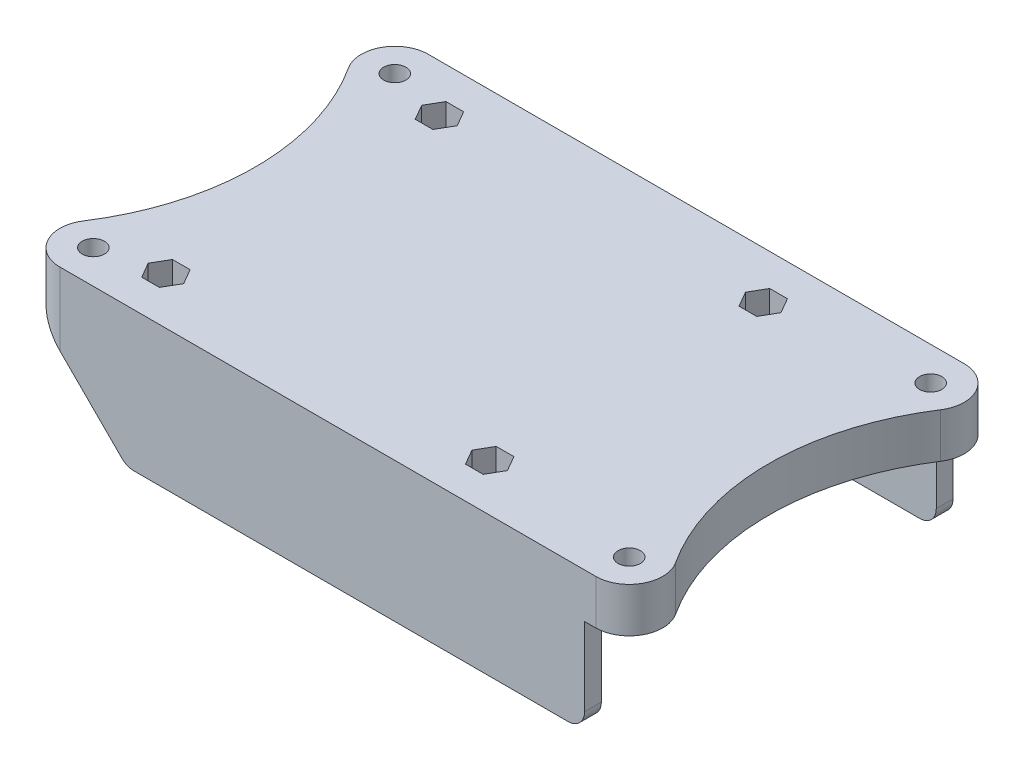
from build123d import *

# Parameters (mm, degrees)
BOSS_EXTRUDE2_DEPTH     = 3
BOSS_EXTRUDE3_DEPTH     = 20
SKETCH7_R               = 3
SKETCH7_R_2             = 1.75
SKETCH7_R_3             = 2.9
SKETCH7_R_4             = 2.1
BOSS_EXTRUDE4_DEPTH     = 4
SKETCH8_R               = 1.35
CUT_EXTRUDE1_DEPTH      = 66.024995194
SKETCH10_W              = 60
SKETCH10_H              = 3
CUT_EXTRUDE2_DEPTH      = 13
FILLET1_R               = 3
SKETCH11_R              = 1.35
BOSS_EXTRUDE5_DEPTH     = 4
FILLET2_R               = 2
BOSS_EXTRUDE6_START     = 5
BOSS_EXTRUDE6_DEPTH     = 5
SKETCH13_R              = 2
BOSS_EXTRUDE7_DEPTH     = 9.5
SKETCH15_R              = 2
BOSS_EXTRUDE9_DEPTH     = 8
BOSS_EXTRUDE11_DEPTH    = 15.5
CUT_EXTRUDE3_DEPTH      = 74.452365517
CUT_EXTRUDE3_DEPTH_BACK = 74.452365517
FILLET4_R               = 1
FILLET5_R               = 3
BOSS_EXTRUDE12_START    = 1
SKETCH22_R              = 2
BOSS_EXTRUDE12_DEPTH    = 1
SKETCH23_W              = 30
SKETCH23_H              = 3
CUT_EXTRUDE6_DEPTH      = 105.393486418


with BuildPart() as part:
    # Sketch4 → Boss-Extrude2 (new body)
    with BuildSketch(Plane(origin=(0, 0, 0), x_dir=(1, 0, 0), z_dir=(0, 1, 0))):
        with BuildLine():
            Line((49.5, 30), (-29.5, 30))
            ThreePointArc((-29.5, 30), (-33.035533906, 28.535533906), (-34.5, 25))
            Line((-34.5, 25), (-34.5, -25))
            ThreePointArc((-34.5, -25), (-33.035533906, -28.535533906), (-29.5, -30))
            Line((-29.5, -30), (49.5, -30))
            Line((49.5, -30), (54.5, -30))
            Line((54.5, -30), (54.5, -25))
            Line((54.5, -25), (54.5, 25))
            Line((54.5, 25), (54.5, 30))
            Line((54.5, 30), (49.5, 30))
        make_face()
    extrude(amount=-BOSS_EXTRUDE2_DEPTH)

    # Sketch5 → Boss-Extrude3 (add)
    with BuildSketch(Plane(origin=(0, 0, 0), x_dir=(1, 0, 0), z_dir=(0, 1, 0))):
        with BuildLine():
            Line((-29.5, -30), (54.5, -30))
            Line((54.5, -30), (54.5, -33))
            Line((54.5, -33), (-29.5, -33))
            ThreePointArc((-29.5, -33), (-35.156854249, -30.656854249), (-37.5, -25))
            Line((-37.5, -25), (-37.5, 25))
            ThreePointArc((-37.5, 25), (-35.156854249, 30.656854249), (-29.5, 33))
            Line((-29.5, 33), (54.5, 33))
            Line((54.5, 33), (54.5, 30))
            Line((54.5, 30), (-29.5, 30))
            ThreePointArc((-29.5, 30), (-33.035533906, 28.535533906), (-34.5, 25))
            Line((-34.5, 25), (-34.5, -25))
            ThreePointArc((-34.5, -25), (-33.035533906, -28.535533906), (-29.5, -30))
        make_face()
    extrude(amount=-BOSS_EXTRUDE3_DEPTH)

    # Sketch7 → Boss-Extrude4 (add)
    with BuildSketch(Plane.XZ.offset(3)):
        with Locations(Location((-29, -24.5, 0), (0, 0, 90))):
            Circle(SKETCH7_R)
        with Locations(Location((-17.5, -16.4, 0), (0, 0, 90))):
            Circle(SKETCH7_R_2)
        with Locations(Location((29, -24.5, 0), (0, 0, 90))):
            Circle(SKETCH7_R)
        with Locations(Location((34.2, 6.8, 0), (0, 0, 90))):
            Circle(SKETCH7_R_3)
        with Locations(Location((29, 24.5, 0), (0, 0, 90))):
            Circle(SKETCH7_R)
        with Locations(Location((-14, 18.2, 0), (0, 0, 90))):
            Circle(SKETCH7_R_4)
        with BuildLine():
            Line((13.073909236, -10.713655198), (10.223909236, -15.65))
            ThreePointArc((10.223909236, -15.65), (4.35, -17.223909236), (2.776090764, -11.35))
            Line((2.776090764, -11.35), (5.626090764, -6.413655198))
            ThreePointArc((5.626090764, -6.413655198), (11.5, -4.839745962), (13.073909236, -10.713655198))
        make_face()
        with BuildLine():
            Line((5, 6.8), (5, -1.9))
            ThreePointArc((5, -1.9), (3.7, -3.2), (2.4, -1.9))
            Line((2.4, -1.9), (2.4, 6.8))
            ThreePointArc((2.4, 6.8), (3.7, 8.1), (5, 6.8))
        make_face()
        with BuildLine():
            Line((0.5, 20.7), (16.5, 20.7))
            ThreePointArc((16.5, 20.7), (18, 19.2), (16.5, 17.7))
            Line((16.5, 17.7), (0.5, 17.7))
            ThreePointArc((0.5, 17.7), (-1, 19.2), (0.5, 20.7))
        make_face()
        with BuildLine():
            Line((-30.5, 9.9), (-30.5, 21.901923789))
            ThreePointArc((-30.5, 21.901923789), (-29, 27.5), (-27.5, 21.901923789))
            Line((-27.5, 21.901923789), (-27.5, 9.9))
            ThreePointArc((-27.5, 9.9), (-29, 8.4), (-30.5, 9.9))
        make_face()
    extrude(amount=BOSS_EXTRUDE4_DEPTH)

    # Sketch8 → Cut-Extrude1 (cut, through all)
    with BuildSketch(Plane.XZ.offset(7)):
        with Locations(Location((-29, -24.5, 0), (0, 0, 270))):
            Circle(SKETCH8_R)
        with Locations(Location((29, -24.5, 0), (0, 0, 270))):
            Circle(SKETCH8_R)
        with Locations(Location((29, 24.5, 0), (0, 0, 270))):
            Circle(SKETCH8_R)
        with Locations(Location((-29, 24.5, 0), (0, 0, 270))):
            Circle(SKETCH8_R)
    extrude(amount=-CUT_EXTRUDE1_DEPTH, mode=Mode.SUBTRACT)

    # Sketch10 → Cut-Extrude2 (cut)
    with BuildSketch(Plane.XZ.offset(20)):
        with Locations((0.5, -31.5)):
            Rectangle(SKETCH10_W, SKETCH10_H)
    extrude(amount=-CUT_EXTRUDE2_DEPTH, mode=Mode.SUBTRACT)

    # Fillet1
    fillet1_edges = [part.edges().sort_by_distance(p)[0] for p in [
        (-29.5, -7, -31.5),
        (30.5, -7, -31.5),
    ]]
    fillet(fillet1_edges, radius=FILLET1_R)

    # Sketch11 → Boss-Extrude5 (add)
    # profile 1 of 4: a face of its own
    with BuildSketch(Plane.XZ.offset(3)):
        with BuildLine():
            Line((-26, 24.5), (-26, 30))
            Line((-26, 30), (-29.5, 30))
            ThreePointArc((-29.5, 30), (-33.035533906, 28.535533906), (-34.5, 25))
            Line((-34.5, 25), (-34.5, 21.5))
            Line((-34.5, 21.5), (-29, 21.5))
            ThreePointArc((-29, 21.5), (-26.878679656, 22.378679656), (-26, 24.5))
        make_face()
        with Locations(Location((-29, 24.5, 0), (0, 0, 270))):
            Circle(SKETCH11_R, mode=Mode.SUBTRACT)
    # profile 2 of 4: a face of its own
    with BuildSketch(Plane.XZ.offset(3)):
        with BuildLine():
            Line((26, 24.5), (26, 30))
            Line((26, 30), (32, 30))
            Line((32, 30), (32, 24.5))
            ThreePointArc((32, 24.5), (29, 21.5), (26, 24.5))
        make_face()
        with Locations(Location((29, 24.5, 0), (0, 0, 270))):
            Circle(SKETCH11_R, mode=Mode.SUBTRACT)
    # profile 3 of 4: a face of its own
    with BuildSketch(Plane.XZ.offset(3)):
        with BuildLine():
            Line((-29, -21.5), (-34.5, -21.5))
            Line((-34.5, -21.5), (-34.5, -25))
            ThreePointArc((-34.5, -25), (-33.035533906, -28.535533906), (-29.5, -30))
            Line((-29.5, -30), (-26, -30))
            Line((-26, -30), (-26, -24.5))
            ThreePointArc((-26, -24.5), (-26.878679656, -22.378679656), (-29, -21.5))
        make_face()
        with Locations(Location((-29, -24.5, 0), (0, 0, 270))):
            Circle(SKETCH11_R, mode=Mode.SUBTRACT)
    # profile 4 of 4: a face of its own
    with BuildSketch(Plane.XZ.offset(3)):
        with BuildLine():
            Line((26, -24.5), (26, -30))
            Line((26, -30), (32, -30))
            Line((32, -30), (32, -24.5))
            ThreePointArc((32, -24.5), (29, -21.5), (26, -24.5))
        make_face()
        with Locations(Location((29, -24.5, 0), (0, 0, 270))):
            Circle(SKETCH11_R, mode=Mode.SUBTRACT)
    extrude(amount=BOSS_EXTRUDE5_DEPTH)

    # Fillet2
    fillet2_edges = [part.edges().sort_by_distance(p)[0] for p in [
        (-27.5, -5, 21.901923789),
        (-30.5, -5, 21.5),
    ]]
    fillet(fillet2_edges, radius=FILLET2_R)

    # Sketch12 → Boss-Extrude6 (add)
    with BuildSketch(Plane(origin=(0, 0, 0), x_dir=(1, 0, 0), z_dir=(0, 1, 0)).offset(BOSS_EXTRUDE6_START)):
        with BuildLine():
            Line((-29.5, -33), (54.5, -33))
            Line((54.5, -33), (54.5, 33))
            Line((54.5, 33), (-29.5, 33))
            ThreePointArc((-29.5, 33), (-35.156854249, 30.656854249), (-37.5, 25))
            Line((-37.5, 25), (-37.5, -25))
            ThreePointArc((-37.5, -25), (-35.156854249, -30.656854249), (-29.5, -33))
        make_face()
        Polygon((-25.824573519, 24.5), (-27.41228676, 27.25), (-30.58771324, 27.25), (-32.175426481, 24.5), (-30.58771324, 21.75), (-27.41228676, 21.75), align=None, mode=Mode.SUBTRACT)
        Polygon((32.175426481, 24.5), (30.58771324, 27.25), (27.41228676, 27.25), (25.824573519, 24.5), (27.41228676, 21.75), (30.58771324, 21.75), align=None, mode=Mode.SUBTRACT)
        Polygon((32.175426481, -24.5), (30.58771324, -21.75), (27.41228676, -21.75), (25.824573519, -24.5), (27.41228676, -27.25), (30.58771324, -27.25), align=None, mode=Mode.SUBTRACT)
        Polygon((-25.824573519, -24.5), (-27.41228676, -21.75), (-30.58771324, -21.75), (-32.175426481, -24.5), (-30.58771324, -27.25), (-27.41228676, -27.25), align=None, mode=Mode.SUBTRACT)
    extrude(amount=-BOSS_EXTRUDE6_DEPTH)

    # Sketch13 → Boss-Extrude7 (add)
    with BuildSketch(Plane(origin=(0, 5, 0), x_dir=(1, 0, 0), z_dir=(0, 1, 0))):
        with BuildLine():
            Line((-39.5, 33), (-29.5, 33))
            Line((-29.5, 33), (-29.5, 32))
            ThreePointArc((-29.5, 32), (-34.449747468, 29.949747468), (-36.5, 25))
            Line((-36.5, 25), (-36.5, -25))
            ThreePointArc((-36.5, -25), (-34.449747468, -29.949747468), (-29.5, -32))
            Line((-29.5, -32), (-29.5, -33))
            Line((-29.5, -33), (-39.5, -33))
            ThreePointArc((-39.5, -33), (-44.77312059, -29.862551177), (-44.531525851, -23.731399748))
            ThreePointArc((-44.531525851, -23.731399748), (-37.5, 0), (-44.531525851, 23.731399748))
            ThreePointArc((-44.531525851, 23.731399748), (-44.77312059, 29.862551177), (-39.5, 33))
        make_face()
        with Locations(Location((-39.5, 27, 0), (0, 0, 270))):
            Circle(SKETCH13_R, mode=Mode.SUBTRACT)
        with Locations(Location((-39.5, -27, 0), (0, 0, 270))):
            Circle(SKETCH13_R, mode=Mode.SUBTRACT)
    extrude(amount=-BOSS_EXTRUDE7_DEPTH)

    # Sketch15 → Boss-Extrude9 (add)
    with BuildSketch(Plane(origin=(0, 5, 0), x_dir=(1, 0, 0), z_dir=(0, 1, 0))):
        with BuildLine():
            Line((53.5, 33), (53.5, -33))
            Line((53.5, -33), (56.5, -33))
            ThreePointArc((56.5, -33), (61.77312059, -29.862551177), (61.531525851, -23.731399748))
            ThreePointArc((61.531525851, -23.731399748), (54.5, 0), (61.531525851, 23.731399748))
            ThreePointArc((61.531525851, 23.731399748), (61.77312059, 29.862551177), (56.5, 33))
            Line((56.5, 33), (53.5, 33))
        make_face()
        with Locations(Location((56.5, 27, 0), (0, 0, 270))):
            Circle(SKETCH15_R, mode=Mode.SUBTRACT)
        with Locations(Location((56.5, -27, 0), (0, 0, 270))):
            Circle(SKETCH15_R, mode=Mode.SUBTRACT)
    extrude(amount=-BOSS_EXTRUDE9_DEPTH)

    # Sketch19 → Boss-Extrude11 (add)
    with BuildSketch(Plane.XZ.offset(4.5)):
        with BuildLine():
            ThreePointArc((-37.5, 25), (-35.156854249, 30.656854249), (-29.5, 33))
            Line((-29.5, 33), (-39.5, 33))
            ThreePointArc((-39.5, 33), (-44.77312059, 29.862551177), (-44.531525851, 23.731399748))
            ThreePointArc((-44.531525851, 23.731399748), (-39.294857215, 12.375597862), (-37.5, 0))
            Line((-37.5, 0), (-37.5, 25))
        make_face()
        with BuildLine():
            Line((-37.5, -25), (-37.5, 0))
            ThreePointArc((-37.5, 0), (-39.294857215, -12.375597862), (-44.531525851, -23.731399748))
            ThreePointArc((-44.531525851, -23.731399748), (-44.77312059, -29.862551177), (-39.5, -33))
            Line((-39.5, -33), (-29.5, -33))
            ThreePointArc((-29.5, -33), (-35.156854249, -30.656854249), (-37.5, -25))
        make_face()
    extrude(amount=BOSS_EXTRUDE11_DEPTH)

    # Sketch17 → Cut-Extrude3 (cut, two sides: drawn at the far end of the back side and taken through both)
    with BuildSketch(Plane.XY.offset(-CUT_EXTRUDE3_DEPTH_BACK)):
        Polygon((-52.5, 5), (-27.5, -20), (-52.5, -20), align=None)
    extrude(amount=CUT_EXTRUDE3_DEPTH + CUT_EXTRUDE3_DEPTH_BACK, mode=Mode.SUBTRACT)

    # Fillet4
    fillet4_edges = [part.edges().sort_by_distance(p)[0] for p in [
        (-29.5, -18, -31.5),
    ]]
    fillet(fillet4_edges, radius=FILLET4_R)

    # Fillet5
    fillet5_edges = [part.edges().sort_by_distance(p)[0] for p in [
        (30.5, -20, -31.5),
        (54.5, -20, 31.5),
        (54.5, -20, -31.5),
        (-27.5, -20, 31.5),
    ]]
    fillet(fillet5_edges, radius=FILLET5_R)

    # Sketch22 → Boss-Extrude12 (add)
    with BuildSketch(Plane(origin=(0, -4.5, 0), x_dir=(1, 0, 0), z_dir=(0, 1, 0)).offset(BOSS_EXTRUDE12_START)):
        with Locations(Location((-39.5, -27, 0), (0, 0, 270))):
            Circle(SKETCH22_R)
        with Locations(Location((-39.5, 27, 0), (0, 0, 270))):
            Circle(SKETCH22_R)
    extrude(amount=-BOSS_EXTRUDE12_DEPTH)

    # Sketch23 → Cut-Extrude6 (cut, through all)
    with BuildSketch(Plane(origin=(-34.5, 0, 0), x_dir=(0, 0, -1), z_dir=(1, 0, 0))):
        with Locations((0, -8)):
            Rectangle(SKETCH23_W, SKETCH23_H)
    extrude(amount=-CUT_EXTRUDE6_DEPTH, mode=Mode.SUBTRACT)


solid = part.part
